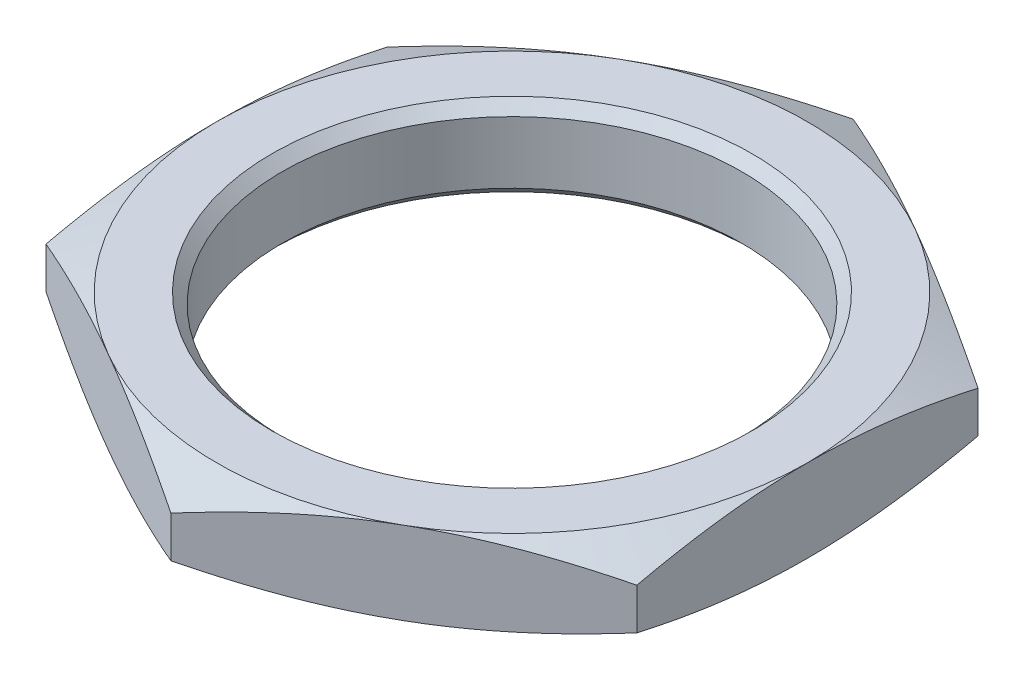
from build123d import *

# Parameters (mm, degrees)
SKETCH1_R           = 5.55625
BOSS_EXTRUDE1_DEPTH = 1
CHAMFER1_SIZE       = 0.25


with BuildPart() as part:
    # Sketch1 → Boss-Extrude1 (new, symmetric)
    with BuildSketch(Plane(origin=(0, 0, 0), x_dir=(1, 0, 0), z_dir=(0, 1, 0))):
        Polygon((0, 8.25), (-7.144709581, 4.125), (-7.144709581, -4.125), (0, -8.25), (7.144709581, -4.125), (7.144709581, 4.125), align=None)
        with Locations(Location((0, 0, 0), (0, 0, 270))):
            Circle(SKETCH1_R, mode=Mode.SUBTRACT)
    extrude(amount=BOSS_EXTRUDE1_DEPTH, both=True)

    # Sketch4 → Cut-Revolve1 (revolve, cut)
    with BuildSketch(Plane.XY):
        Polygon((-7.144709581, 1), (-8.25, 0.5), (-8.644709581, 0.5), (-8.644709581, 2), (-7.144709581, 2), align=None)
        Polygon((-7.144709581, -2), (-7.144709581, -1), (-8.25, -0.5), (-8.644709581, -0.5), (-8.644709581, -2), align=None)
    revolve(axis=Axis((0, 1, 0), (0, -1, 0)), mode=Mode.SUBTRACT)

    # Chamfer1
    chamfer1_edges = [part.edges().sort_by_distance(p)[0] for p in [
        (0, -1, -5.55625),
        (0, 1, -5.55625),
    ]]
    chamfer(chamfer1_edges, length=CHAMFER1_SIZE)


solid = part.part
